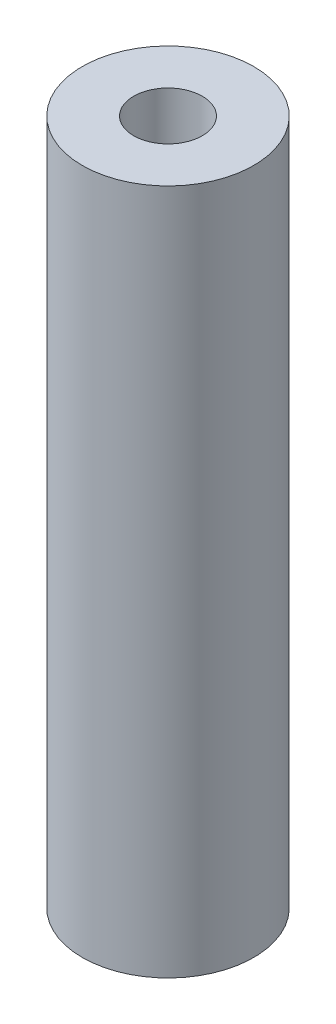
from build123d import *

# Parameters (mm, degrees)
SKETCH_1_R      = 2.5
SKETCH_1_R_2    = 1
EXTRUDE_1_DEPTH = 10


with BuildPart() as part:
    # Эскиз1 → Бобышка-Вытянуть1 (new, symmetric)
    with BuildSketch(Plane(origin=(0, 0, 0), x_dir=(1, 0, 0), z_dir=(0, 1, 0))):
        with Locations(Location((0, 0, 0), (0, 0, 270))):
            Circle(SKETCH_1_R)
        with Locations(Location((0, 0, 0), (0, 0, 270))):
            Circle(SKETCH_1_R_2, mode=Mode.SUBTRACT)
    extrude(amount=EXTRUDE_1_DEPTH, both=True)


solid = part.part
